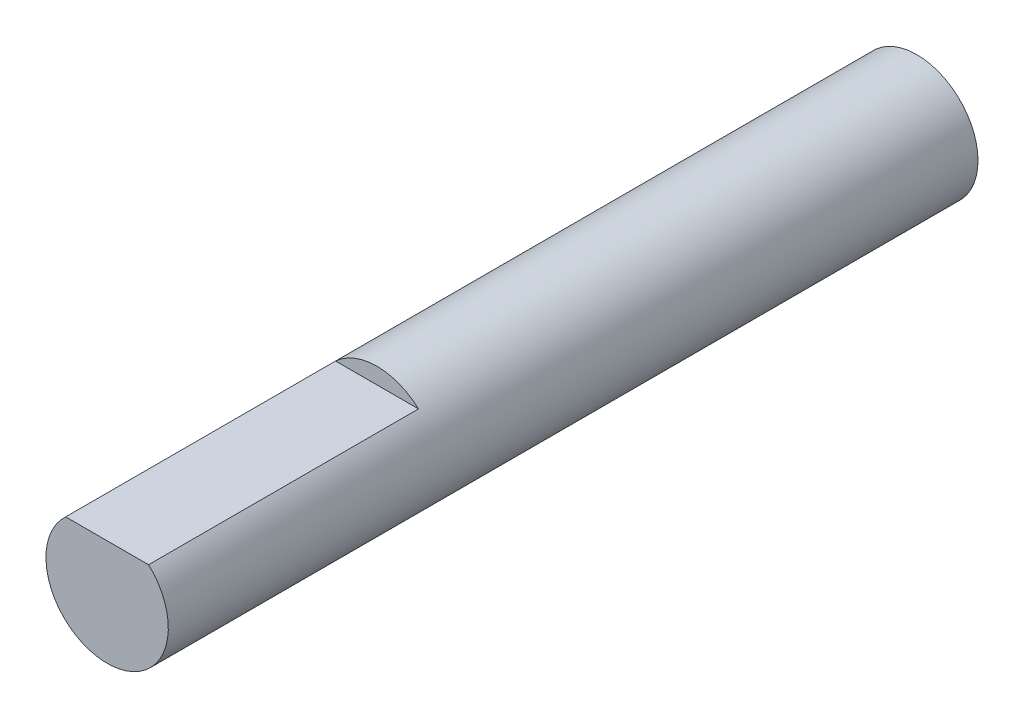
from build123d import *

# Parameters (mm, degrees)
BOSS_EXTRUDE1_DEPTH = 76.2
BOSS_EXTRUDE2_START = -152.4
SKETCH1_4_R         = 17.272
BOSS_EXTRUDE2_DEPTH = 152.4


with BuildPart() as part:
    # Sketch1 → Boss-Extrude1 (new body)
    with BuildSketch(Plane.XY):
        with BuildLine():
            ThreePointArc((17.272, 0), (15.819436748, 6.93306606), (11.70606612, 12.7))
            Line((11.70606612, 12.7), (-11.70606612, 12.7))
            ThreePointArc((-11.70606612, 12.7), (-6.93306606, -15.819436748), (17.272, 0))
        make_face()
    extrude(amount=BOSS_EXTRUDE1_DEPTH)

    # Sketch1<4> → Boss-Extrude2 (add)
    with BuildSketch(Plane.XY.offset(BOSS_EXTRUDE2_START)):
        Circle(SKETCH1_4_R)
    extrude(amount=BOSS_EXTRUDE2_DEPTH)


solid = part.part
